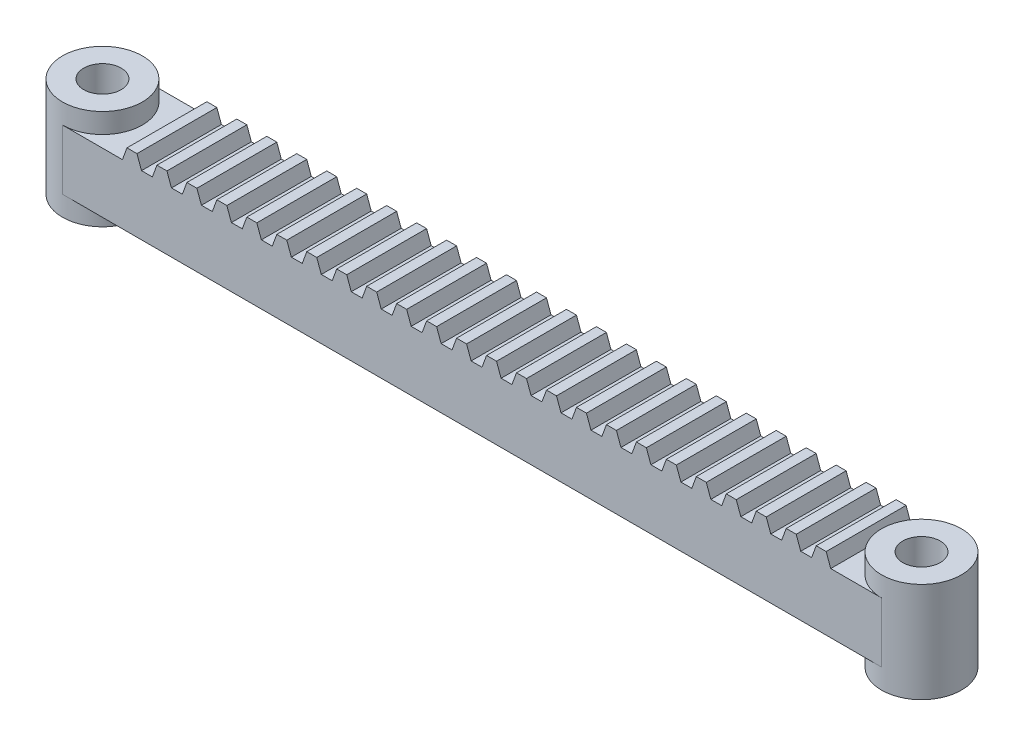
from build123d import *

# Parameters (mm, degrees)
SKETCH2_R             = 8
SKETCH2_R_2           = 3.75
BOSS_EXTRUDE1_DEPTH   = 10
BOSS_EXTRUDE1_2_DEPTH = 10
BOSS_EXTRUDE2_DEPTH   = 6
BOSS_EXTRUDE3_DEPTH   = 16


with BuildPart() as part:
    # Sketch2 → Boss-Extrude1 (new, symmetric)
    with BuildSketch(Plane(origin=(0, 0, 0), x_dir=(1, 0, 0), z_dir=(0, 1, 0))):
        with Locations((82, 0)):
            Circle(SKETCH2_R)
        with Locations((82, 0)):
            Circle(SKETCH2_R_2, mode=Mode.SUBTRACT)
    extrude(amount=BOSS_EXTRUDE1_DEPTH, both=True)



with BuildPart() as body_2:
    # Sketch2 → Boss-Extrude1 2 (new, symmetric)
    with BuildSketch(Plane(origin=(0, 0, 0), x_dir=(1, 0, 0), z_dir=(0, 1, 0))):
        with Locations((-82, 0)):
            Circle(SKETCH2_R)
        with Locations((-82, 0)):
            Circle(SKETCH2_R_2, mode=Mode.SUBTRACT)
    extrude(amount=BOSS_EXTRUDE1_2_DEPTH, both=True)


with BuildPart() as part_1:
    add(part.part)

    add(body_2.part)  # Boss-Extrude2 merges body 2
    # Sketch2<3> → Boss-Extrude2 (add, symmetric)
    with BuildSketch(Plane(origin=(0, 0, 0), x_dir=(1, 0, 0), z_dir=(0, 1, 0))):
        with BuildLine():
            Line((-82, -8), (82, -8))
            ThreePointArc((82, -8), (74, 0), (82, 8))
            Line((82, 8), (-82, 8))
            ThreePointArc((-82, 8), (-76.343145751, 5.656854249), (-74, 0))
            ThreePointArc((-74, 0), (-76.343145751, -5.656854249), (-82, -8))
        make_face()
    extrude(amount=BOSS_EXTRUDE2_DEPTH, both=True)

    # Sketch3 → Boss-Extrude3 (add)
    with BuildSketch(Plane.XY.offset(8)):
        Polygon((-70, 6), (-69.090074414, 8.5), (-67.090074414, 8.5), (-66.180148829, 6), (-64, 6), (-63.090074414, 8.5), (-61.090074414, 8.5), (-60.180148829, 6), (-58, 6), (-57.090074414, 8.5), (-55.090074414, 8.5), (-54.180148829, 6), (-52, 6), (-51.090074414, 8.5), (-49.090074414, 8.5), (-48.180148829, 6), (-46, 6), (-45.090074414, 8.5), (-43.090074414, 8.5), (-42.180148829, 6), (-40, 6), (-39.090074414, 8.5), (-37.090074414, 8.5), (-36.180148829, 6), (-34, 6), (-33.090074414, 8.5), (-31.090074414, 8.5), (-30.180148829, 6), (-28, 6), (-27.090074414, 8.5), (-25.090074414, 8.5), (-24.180148829, 6), (-22, 6), (-21.090074414, 8.5), (-19.090074414, 8.5), (-18.180148829, 6), (-16, 6), (-15.090074414, 8.5), (-13.090074414, 8.5), (-12.180148829, 6), (-10, 6), (-9.090074414, 8.5), (-7.090074414, 8.5), (-6.180148829, 6), (-4, 6), (-3.090074414, 8.5), (-1.090074414, 8.5), (-0.180148829, 6), (2, 6), (2.909925586, 8.5), (4.909925586, 8.5), (5.819851171, 6), (8, 6), (8.909925586, 8.5), (10.909925586, 8.5), (11.819851171, 6), (14, 6), (14.909925586, 8.5), (16.909925586, 8.5), (17.819851171, 6), (20, 6), (20.909925586, 8.5), (22.909925586, 8.5), (23.819851171, 6), (26, 6), (26.909925586, 8.5), (28.909925586, 8.5), (29.819851171, 6), (32, 6), (32.909925586, 8.5), (34.909925586, 8.5), (35.819851171, 6), (38, 6), (38.909925586, 8.5), (40.909925586, 8.5), (41.819851171, 6), (44, 6), (44.909925586, 8.5), (46.909925586, 8.5), (47.819851171, 6), (50, 6), (50.909925586, 8.5), (52.909925586, 8.5), (53.819851171, 6), (56, 6), (56.909925586, 8.5), (58.909925586, 8.5), (59.819851171, 6), (62, 6), (62.909925586, 8.5), (64.909925586, 8.5), (65.819851171, 6), (68, 6), (68.909925586, 8.5), (70.909925586, 8.5), (71.819851171, 6), (74, 6), (74, 3.396529526), (-72.978333453, 3.396529526), (-72.978333453, 6), align=None)
    extrude(amount=-BOSS_EXTRUDE3_DEPTH)


solid = part_1.part
